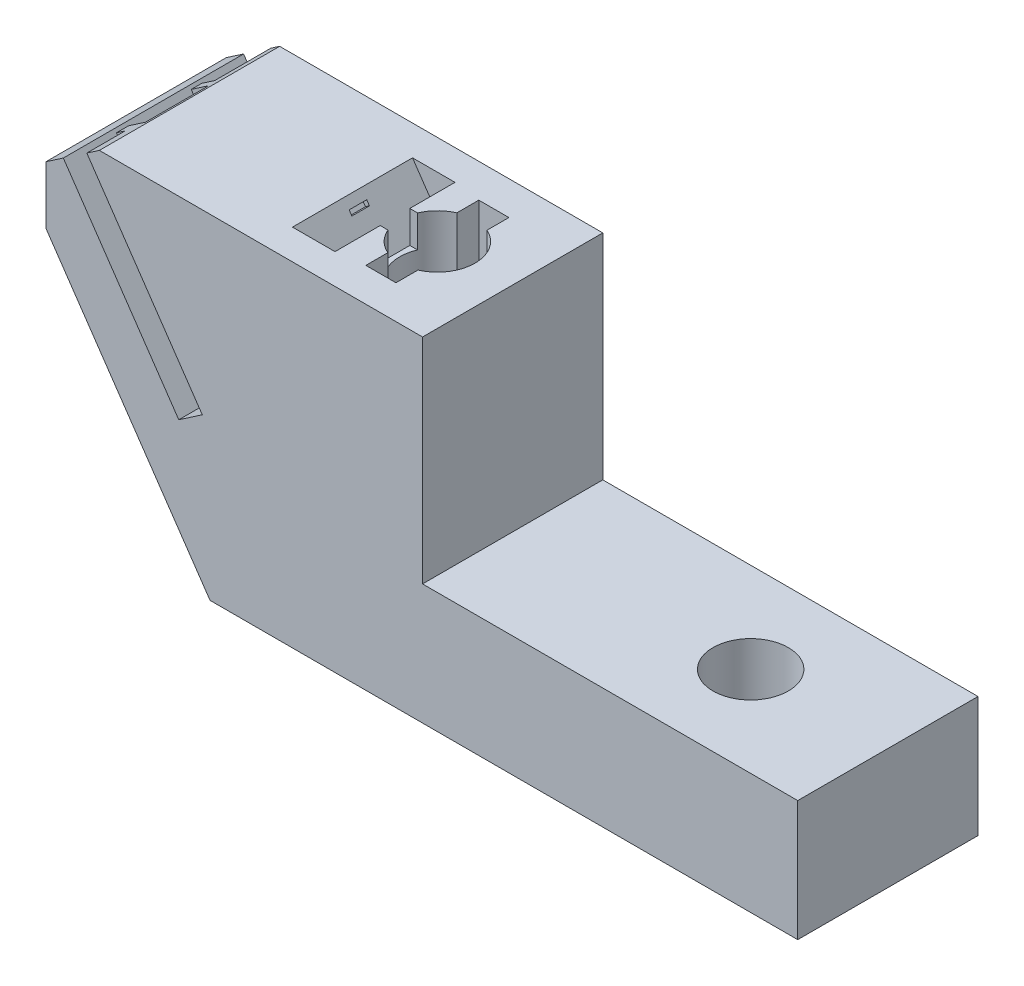
from build123d import *
from build123d.topology import SkipClean

# Parameters (mm, degrees)
BOSS_EXTRUDE1_DEPTH     = 2.5
BOSS_EXTRUDE1_2_DEPTH   = 2.5
BOSS_EXTRUDE2_DEPTH     = 6.35
BOSS_EXTRUDE3_DEPTH     = 6.35
SKETCH4_R               = 3.175
CUT_EXTRUDE1_DEPTH      = 25.4
SKETCH5_R               = 1.5875
CUT_EXTRUDE2_DEPTH      = 25.4
CUT_EXTRUDE3_DEPTH      = 25.4
CUT_EXTRUDE4_REACH      = 43
CUT_EXTRUDE4_END_RADIUS = 3.175
CUT_EXTRUDE5_REACH      = 39.36
SKETCH8_W               = 2.54
SKETCH8_H               = 9.525
SKETCH9_W               = 0.7112
SKETCH9_H               = 15.2
BOSS_EXTRUDE4_DEPTH     = 17
BOSS_EXTRUDE5_DEPTH     = 1.016
SKETCH11_W              = 1.176658287
SKETCH11_H              = 2.5
SKETCH11_W_2            = 2.636987944
SKETCH11_H_2            = 15.2
BOSS_EXTRUDE6_DEPTH     = 1.27
CUT_EXTRUDE6_DEPTH      = 38.864332241
BOSS_EXTRUDE7_START     = 2.54
BOSS_EXTRUDE7_DEPTH     = 2.54
BOSS_EXTRUDE8_DEPTH     = 2.54
BOSS_EXTRUDE9_DEPTH     = 0.508
BOSS_EXTRUDE10_DEPTH    = 0.508
CUT_EXTRUDE7_DEPTH      = 3.81
CUT_EXTRUDE8_DEPTH      = 3.81
BOSS_EXTRUDE11_DEPTH    = 3.81
BOSS_EXTRUDE12_START    = -10.16
SKETCH21_W              = 49.554714962
SKETCH21_H              = 15.2
SKETCH21_R              = 3.175
BOSS_EXTRUDE12_DEPTH    = 10.16


with BuildPart() as part:
    # Sketch1 → Boss-Extrude1 (new body)
    with BuildSketch(Plane.XY):
        Polygon((5.08, 0), (0, 0), (0, 19.141079028), (-1.033059908, 19.141079028), (-3.75575709, 23.125698967), (-8.376397661, 9.077684872), (-11.679025045, 6.820994294), (-21.26996, 20.857160675), (-22.86, 19.770683798), (-22.86, -3.81), (8.89, -3.81), (8.89, 24.384), (5.08, 24.384), align=None)
    extrude(amount=BOSS_EXTRUDE1_DEPTH)



with BuildPart() as body_2:
    # Sketch1 → Boss-Extrude1 2 (new body)
    with BuildSketch(Plane.XY):
        Polygon((-10.069369191, 23.749), (-4.328956497, 23.964566322), (-4.615556201, 24.384), (-16.108492032, 24.384), (-17.03780348, 23.749), align=None)
    extrude(amount=BOSS_EXTRUDE1_2_DEPTH)


with BuildPart() as part_1:
    add(part.part)

    add(body_2.part)  # Boss-Extrude2 merges body 2
    # Sketch2 → Boss-Extrude2 (add)
    with BuildSketch(Plane.XY.offset(2.5)):
        Polygon((-11.679025045, 6.820994294), (-21.26996, 20.857160675), (-22.86, 19.770683798), (-22.86, -3.81), (8.89, -3.81), (8.89, 24.384), (5.08, 24.384), (5.08, 0), (0, 0), (0, 19.141079028), (-1.033059908, 19.141079028), (-3.75575709, 23.125698967), (-8.376397661, 9.077684872), align=None)
        Polygon((-16.108492032, 24.384), (-18.00931945, 23.085161582), (-8.418384495, 9.048995201), (-8.376397661, 9.077684872), (-3.75575709, 23.125698967), (-1.033059908, 19.141079028), (0, 19.141079028), (0, 0), (5.08, 0), (5.08, 24.384), align=None)
    extrude(amount=BOSS_EXTRUDE2_DEPTH)

    # Sketch3 → Boss-Extrude3 (add)
    with BuildSketch(Plane(origin=(0, 0, 0), x_dir=(-1, 0, 0), z_dir=(0, 0, -1))):
        Polygon((-8.89, 24.384), (-8.89, -3.81), (22.86, -3.81), (22.86, 19.770683798), (21.26996, 20.857160675), (11.679025045, 6.820994294), (8.376397661, 9.077684872), (18.00931945, 23.085161582), (16.108492032, 24.384), align=None)
    extrude(amount=BOSS_EXTRUDE3_DEPTH)

    # Sketch4 → Cut-Extrude1 (cut)
    with BuildSketch(Plane(origin=(0, 24.384, 0), x_dir=(1, 0, 0), z_dir=(0, 1, 0))):
        with Locations(Location((2.54, -1.25, 0), (0, 0, 270))):
            Circle(SKETCH4_R)
    extrude(amount=-CUT_EXTRUDE1_DEPTH, mode=Mode.SUBTRACT)

    # Sketch5 → Cut-Extrude2 (cut)
    with BuildSketch(Plane(origin=(0, -1.016, 0), x_dir=(1, 0, 0), z_dir=(0, 1, 0))):
        with Locations(Location((2.54, -1.25, 0), (0, 0, 270))):
            Circle(SKETCH5_R)
    extrude(amount=-CUT_EXTRUDE2_DEPTH, mode=Mode.SUBTRACT)

    # Sketch6 → Cut-Extrude3 (cut)
    with BuildSketch(Plane.XY.offset(8.85)):
        Polygon((-22.86, 16.430904611), (-9.029357481, -3.81), (-22.86, -3.81), align=None)
    extrude(amount=-CUT_EXTRUDE3_DEPTH, mode=Mode.SUBTRACT)

    # Cut-Extrude4: up to this cylinder (the profile starts outside it)
    with SkipClean():  # the faces are left unmerged after this step: merging them gives an invalid solid
        cut_extrude4_end = Plane(origin=(2.54, 2.159, 1.25), z_dir=(0, 1, 0)) * Cylinder(CUT_EXTRUDE4_END_RADIUS, 96.045024, mode=Mode.PRIVATE)
        # Sketch7 → Cut-Extrude4 (cut, up to the surface)
        with BuildSketch(Plane(origin=(8.89, 0, 0), x_dir=(0, 0, -1), z_dir=(1, 0, 0)), mode=Mode.PRIVATE) as cut_extrude4_sk1:
            with BuildLine():
                ThreePointArc((1.925, 2.159), (-1.25, 5.334), (-4.425, 2.159))
                Line((-4.425, 2.159), (1.925, 2.159))
            make_face()
        cut_extrude4_tool1 = extrude(cut_extrude4_sk1.sketch, amount=-CUT_EXTRUDE4_REACH, mode=Mode.PRIVATE) - cut_extrude4_end
        add(cut_extrude4_tool1.solids().sort_by_distance((8.89, 3.506512, 1.25))[0], mode=Mode.SUBTRACT)
        # Sketch7 → Cut-Extrude4 (cut, up to the surface)
        with BuildSketch(Plane(origin=(8.89, 0, 0), x_dir=(0, 0, -1), z_dir=(1, 0, 0)), mode=Mode.PRIVATE) as cut_extrude4_sk2:
            with BuildLine():
                Line((1.925, 2.159), (-4.425, 2.159))
                ThreePointArc((-4.425, 2.159), (-3.49506403, -0.08606403), (-1.25, -1.016))
                ThreePointArc((-1.25, -1.016), (0.99506403, -0.08606403), (1.925, 2.159))
            make_face()
        cut_extrude4_tool2 = extrude(cut_extrude4_sk2.sketch, amount=-CUT_EXTRUDE4_REACH, mode=Mode.PRIVATE) - cut_extrude4_end
        add(cut_extrude4_tool2.solids().sort_by_distance((8.89, 0.811488, 1.25))[0], mode=Mode.SUBTRACT)
        # Sketch7 → Cut-Extrude4 (cut, up to the surface)
        with BuildSketch(Plane(origin=(8.89, 0, 0), x_dir=(0, 0, -1), z_dir=(1, 0, 0)), mode=Mode.PRIVATE) as cut_extrude4_sk3:
            with BuildLine():
                ThreePointArc((1.925, 2.159), (-1.25, 5.334), (-4.425, 2.159))
                Line((-4.425, 2.159), (1.925, 2.159))
            make_face()
        cut_extrude4_tool3 = extrude(cut_extrude4_sk3.sketch, amount=-CUT_EXTRUDE4_REACH, mode=Mode.PRIVATE) - cut_extrude4_end
        add(cut_extrude4_tool3.solids().sort_by_distance((8.89, 3.506512, 1.25))[0], mode=Mode.SUBTRACT)
        # Sketch7 → Cut-Extrude4 (cut, up to the surface)
        with BuildSketch(Plane(origin=(8.89, 0, 0), x_dir=(0, 0, -1), z_dir=(1, 0, 0)), mode=Mode.PRIVATE) as cut_extrude4_sk4:
            with BuildLine():
                Line((1.925, 2.159), (-4.425, 2.159))
                ThreePointArc((-4.425, 2.159), (-3.49506403, -0.08606403), (-1.25, -1.016))
                ThreePointArc((-1.25, -1.016), (0.99506403, -0.08606403), (1.925, 2.159))
            make_face()
        cut_extrude4_tool4 = extrude(cut_extrude4_sk4.sketch, amount=-CUT_EXTRUDE4_REACH, mode=Mode.PRIVATE) - cut_extrude4_end
        add(cut_extrude4_tool4.solids().sort_by_distance((8.89, 0.811488, 1.25))[0], mode=Mode.SUBTRACT)

    # Cut-Extrude5: up to this face of the body (flat: up to its plane)
    cut_extrude5_end = Plane(part_1.part.faces().sort_by_distance((4.72156403, -1.016, 3.43156403))[0])
    # Sketch8 → Cut-Extrude5 (cut, up to the picked face)
    with BuildSketch(Plane(origin=(0, 24.384, 0), x_dir=(1, 0, 0), z_dir=(0, 1, 0)), mode=Mode.PRIVATE) as cut_extrude5_sk1:
        with Locations((2.54, -1.25)):
            Rectangle(SKETCH8_W, SKETCH8_H)
    cut_extrude5_tool1 = split(extrude(cut_extrude5_sk1.sketch, amount=-CUT_EXTRUDE5_REACH, mode=Mode.PRIVATE), bisect_by=cut_extrude5_end, keep=Keep.BOTH, mode=Mode.PRIVATE)
    add(cut_extrude5_tool1.solids().sort_by(Axis((2.54, 24.384, 1.25), (0, -1, 0)))[0], mode=Mode.SUBTRACT)

    # Sketch9 → Boss-Extrude4 (add)
    with BuildSketch(Plane(origin=(-6.894633763, 10.090176515, 0), x_dir=(0.825656845959394, 0.5641726444275594, 0), z_dir=(-0.5641726444275594, 0.825656845959394, 0))):
        with Locations((-5.439048594, -1.25)):
            Rectangle(SKETCH9_W, SKETCH9_H)
        Polygon((-1.794648594, 6.35), (-2.302648594, 6.35), (-2.302648594, 1.6202), (-3.623501238, 1.6202), (-3.623501238, 0.7312), (-1.794648594, 0.7312), align=None)
        Polygon((-1.845501238, -8.85), (-1.845501238, -4.6028), (-3.572648594, -4.6028), (-3.572648594, -5.6188), (-2.683648594, -5.6188), (-2.683648594, -8.85), align=None)
    extrude(amount=BOSS_EXTRUDE4_DEPTH)

    # Sketch10 → Boss-Extrude5 (add)
    with BuildSketch(Plane(origin=(-6.894633763, 10.090176515, 0), x_dir=(0.8256568459593948, 0.5641726444275585, 0), z_dir=(-0.5641726444275585, 0.8256568459593948, 0))):
        Polygon((-5.083448594, -8.85), (-2.683648594, -8.85), (-2.683648594, -5.6188), (-3.572648594, -5.6188), (-3.572648594, -4.6028), (-1.845501238, -4.6028), (-1.845501238, -2.5), (-1.794648594, -2.5), (-1.794648594, 0), (-1.794648594, 0.7312), (-3.623501238, 0.7312), (-3.623501238, 1.6202), (-2.302648594, 1.6202), (-2.302648594, 6.35), (-5.083448594, 6.35), align=None)
    extrude(amount=BOSS_EXTRUDE5_DEPTH)

    # Sketch11 → Boss-Extrude6 (add)
    with BuildSketch(Plane(origin=(-16.485568719, 24.126342896, 0), x_dir=(0.8256568459593935, 0.5641726444275603, 0), z_dir=(-0.5641726444275603, 0.8256568459593935, 0))):
        with Locations((-1.257172095, -1.25)):
            Rectangle(SKETCH11_W, SKETCH11_H)
        Polygon((-3.623501238, 1.6202), (-3.623501238, 0.7312), (-1.845501238, 0.7312), (-1.845501238, 0), (-0.668842951, 0), (-0.668842951, -2.5), (-1.845501238, -2.5), (-1.845501238, -4.6028), (-3.572648594, -4.6028), (-3.572648594, -5.6188), (-2.683648594, -5.6188), (-2.683648594, -8.85), (0.456699038, -8.85), (0.456699038, 6.35), (-2.302648594, 6.35), (-2.302648594, 1.6202), align=None)
        with Locations((-6.401942566, -1.25)):
            Rectangle(SKETCH11_W_2, SKETCH11_H_2)
    extrude(amount=BOSS_EXTRUDE6_DEPTH)

    # Sketch12 → Cut-Extrude6 (cut, through all)
    with BuildSketch(Plane.XY.offset(8.85)):
        Polygon((-16.108492032, 24.384), (-18.359576008, 24.384), (-16.82499129, 25.432584194), align=None)
        Polygon((-22.86, 19.770683798), (-22.86, 21.308853083), (-23.576499258, 20.819267993), align=None)
    extrude(amount=-CUT_EXTRUDE6_DEPTH, mode=Mode.SUBTRACT)

    # Sketch13 → Boss-Extrude7 (add)
    with BuildSketch(Plane(origin=(0, 19.141079028, 0), x_dir=(1, 0, 0), z_dir=(0, 1, 0)).offset(BOSS_EXTRUDE7_START)):
        with BuildLine():
            Line((-0.378582704, 0), (-1.033059908, 0))
            Line((-1.033059908, 0), (-1.033059908, -2.5))
            Line((-1.033059908, -2.5), (-0.378582704, -2.5))
            ThreePointArc((-0.378582704, -2.5), (-0.635, -1.25), (-0.378582704, 0))
        make_face()
    extrude(amount=-BOSS_EXTRUDE7_DEPTH)

    # Sketch15 → Boss-Extrude8 (add)
    with BuildSketch(Plane.XY):
        Polygon((-4.156996675, 23.712906116), (-4.328956497, 23.964566322), (-4.808856613, 23.946544917), (-4.492543617, 23.483626353), align=None)
        Polygon((-3.75575709, 23.125698967), (-3.927716912, 23.377359173), (-4.263263855, 23.148079411), (-3.915700647, 22.639426706), align=None)
    extrude(amount=BOSS_EXTRUDE8_DEPTH)

    # Sketch16 → Boss-Extrude9 (add)
    with BuildSketch(Plane.XY):
        Polygon((-4.263263855, 23.148079411), (-4.492543617, 23.483626353), (-4.156996675, 23.712906116), (-3.927716912, 23.377359173), align=None)
    extrude(amount=BOSS_EXTRUDE9_DEPTH)

    # Sketch17 → Boss-Extrude10 (add)
    with BuildSketch(Plane(origin=(0, 0, 2.5), x_dir=(-1, 0, 0), z_dir=(0, 0, -1))):
        Polygon((4.263263855, 23.148079411), (4.492543617, 23.483626353), (4.156996675, 23.712906116), (3.927716912, 23.377359173), align=None)
    extrude(amount=BOSS_EXTRUDE10_DEPTH)

    # Sketch18 → Cut-Extrude7 (cut)
    with BuildSketch(Plane(origin=(0, 0, 2.5), x_dir=(-1, 0, 0), z_dir=(0, 0, -1))):
        Polygon((1.033059908, 24.384), (1.033059908, 21.681079028), (1.033059908, 19.141079028), (4.615556201, 24.384), align=None)
    extrude(amount=-CUT_EXTRUDE7_DEPTH, mode=Mode.SUBTRACT)

    # Sketch19 → Cut-Extrude8 (cut)
    with BuildSketch(Plane.XY):
        Polygon((-1.033059908, 19.141079028), (-1.033059908, 21.681079028), (-1.033059908, 24.384), (-4.615556201, 24.384), align=None)
    extrude(amount=-CUT_EXTRUDE8_DEPTH, mode=Mode.SUBTRACT)

    # Sketch20 → Boss-Extrude11 (add)
    with BuildSketch(Plane.XY):
        Polygon((-10.069369191, 23.749), (-4.492543617, 23.483626353), (-4.808856613, 23.946544917), align=None)
    extrude(amount=BOSS_EXTRUDE11_DEPTH)

    # Sketch21 → Boss-Extrude12 (add)
    with BuildSketch(Plane.XZ.offset(3.81).offset(BOSS_EXTRUDE12_START)):
        with Locations((15.748, 1.25)):
            Rectangle(SKETCH21_W, SKETCH21_H)
        with Locations(Location((2.54, 1.25, 0), (0, 0, 90))):
            Circle(SKETCH21_R, mode=Mode.SUBTRACT)
        with Locations(Location((28.956, 1.25, 0), (0, 0, 270))):
            Circle(SKETCH21_R, mode=Mode.SUBTRACT)
    extrude(amount=BOSS_EXTRUDE12_DEPTH)


solid = part_1.part
